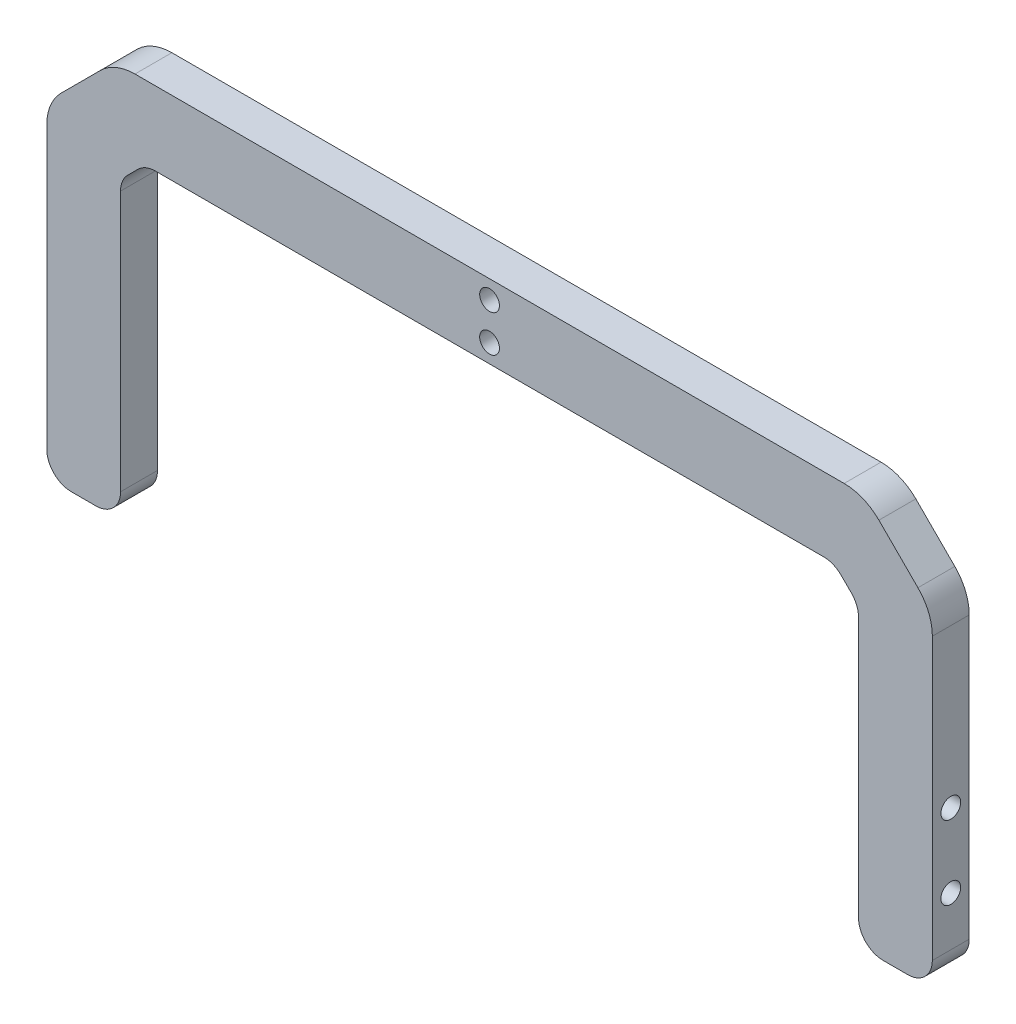
from build123d import *

# Parameters (mm, degrees)
BOSS_EXTRUDE1_DEPTH              = 9.525
FILLET3_R                        = 6.35
FILLET1_R                        = 12.7
F_1_4_20_TAPPED_HOLE1_D          = 5.1054
F_1_4_20_TAPPED_HOLE2_AT_2_COUNT = 2
F_1_4_20_TAPPED_HOLE2_AT_2_PITCH = 19.05


with BuildPart() as part:
    # Sketch1 → Boss-Extrude1 (new body)
    with BuildSketch(Plane.XY):
        Polygon((-114.3, -17.509231637), (-96.790768363, 0), (96.790768363, 0), (114.3, -17.509231637), (114.3, -101.6), (95.25, -101.6), (95.25, -25.4), (88.9, -19.05), (-88.9, -19.05), (-95.25, -25.4), (-95.25, -101.6), (-114.3, -101.6), align=None)
    extrude(amount=BOSS_EXTRUDE1_DEPTH)

    # Fillet3
    fillet3_edges = [part.edges().sort_by_distance(p)[0] for p in [
        (114.3, -101.6, 4.7625),
        (95.25, -101.6, 4.7625),
        (95.25, -25.4, 4.7625),
        (88.9, -19.05, 4.7625),
        (-88.9, -19.05, 4.7625),
        (-95.25, -25.4, 4.7625),
        (-95.25, -101.6, 4.7625),
        (-114.3, -101.6, 4.7625),
    ]]
    fillet(fillet3_edges, radius=FILLET3_R)

    # Fillet1
    fillet1_edges = [part.edges().sort_by_distance(p)[0] for p in [
        (-114.3, -17.509231637, 4.7625),
        (-96.790768363, 0, 4.7625),
        (96.790768363, 0, 4.7625),
        (114.3, -17.509231637, 4.7625),
    ]]
    fillet(fillet1_edges, radius=FILLET1_R)

    # 1/4-20 Tapped Hole1 (through all)
    with Locations(Plane.XY.offset(9.525)):
        with Locations((0, -4.7625), (0, -14.2875)):
            Hole(F_1_4_20_TAPPED_HOLE1_D / 2)

    # Sketch5 → 1/4-20 Tapped Hole2 (revolve, cut)
    with BuildSketch(Plane(origin=(114.3, -82.55, 4.7625), x_dir=(0, 0, -1), z_dir=(0, 1, 0))):
        Polygon((0, 0), (0, 17.408816902), (2.5527, 15.875), (2.5527, 0), align=None)
    f_1_4_20_tapped_hole2 = revolve(axis=Axis((120.65, -82.55, 4.7625), (-1, 0, 0)), mode=Mode.SUBTRACT)

    # 1/4-20 Tapped Hole2 at 2: 1/4-20 Tapped Hole2 ×2
    with Locations(*[(0, i * F_1_4_20_TAPPED_HOLE2_AT_2_PITCH, 0) for i in range(1, F_1_4_20_TAPPED_HOLE2_AT_2_COUNT)]):
        add(f_1_4_20_tapped_hole2, mode=Mode.SUBTRACT)

    # Mirror1: 1/4-20 Tapped Hole2 across plane
    add(f_1_4_20_tapped_hole2.mirror(Plane(origin=(0, 0, 0), x_dir=(0, 0, 1), z_dir=(1, 0, 0))), mode=Mode.SUBTRACT)

    # Mirror1 copy 1 sketch → Mirror1 copy 1 (revolve, cut)
    with BuildSketch(Plane(origin=(-114.3, -63.5, 4.7625), x_dir=(0, 0, -1), z_dir=(0, 1, 0))):
        Polygon((0, 0), (0, -17.408816902), (2.5527, -15.875), (2.5527, 0), align=None)
    revolve(axis=Axis((-120.65, -63.5, 4.7625), (-1, 0, 0)), mode=Mode.SUBTRACT)


solid = part.part
